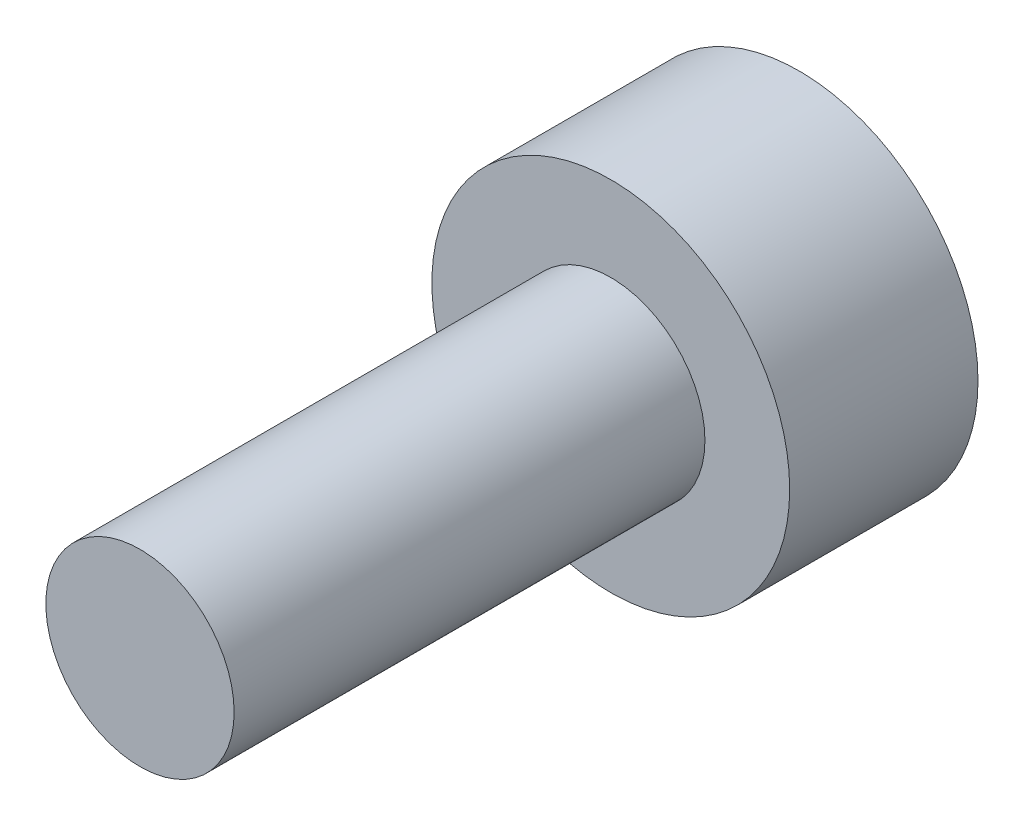
from build123d import *

# Parameters (mm, degrees)
HEAD_ENVELOPE_START         = -2
SKETCH1_R                   = 1.9
HEAD_ENVELOPE_DEPTH         = 2
SKETCH2_R                   = 1
THREAD_MAJOR_ENVELOPE_DEPTH = 5


with BuildPart() as part:
    # Sketch1 → Head_Envelope (new body)
    with BuildSketch(Plane.XY.offset(HEAD_ENVELOPE_START)):
        Circle(SKETCH1_R)
    extrude(amount=HEAD_ENVELOPE_DEPTH)

    # Sketch2 → Thread_Major_Envelope (add)
    with BuildSketch(Plane.XY):
        Circle(SKETCH2_R)
    extrude(amount=THREAD_MAJOR_ENVELOPE_DEPTH)


solid = part.part
